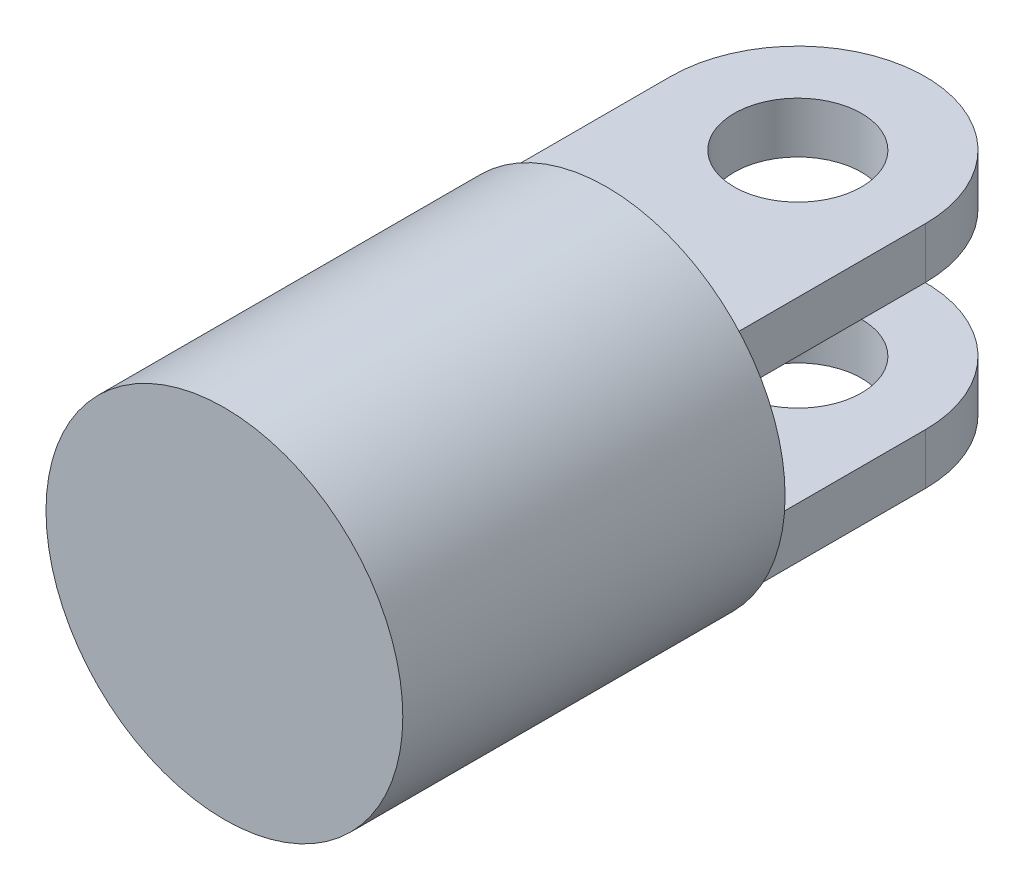
from build123d import *

# Parameters (mm, degrees)
SKETCH_1_R          = 14
EXTRUDE_1_DEPTH     = 30
SKETCH_2_R          = 5
EXTRUDE_2_DEPTH     = 9
SKETCH_2_3_R        = 5
CUT_EXTRUDE_1_DEPTH = 5


with BuildPart() as part:
    # 草图1 → 凸台-拉伸1 (new body)
    with BuildSketch(Plane.XY):
        Circle(SKETCH_1_R)
    extrude(amount=EXTRUDE_1_DEPTH)

    # 草图2 → 凸台-拉伸2 (add, symmetric)
    with BuildSketch(Plane(origin=(0, 0, 0), x_dir=(1, 0, 0), z_dir=(0, 1, 0))):
        with BuildLine():
            Line((10, 15), (10, 0))
            Line((10, 0), (-10, 0))
            Line((-10, 0), (-10, 15))
            ThreePointArc((-10, 15), (0, 25), (10, 15))
        make_face()
        with Locations((0, 15)):
            Circle(SKETCH_2_R, mode=Mode.SUBTRACT)
    extrude(amount=EXTRUDE_2_DEPTH, both=True)

    # 草图2<3> → 切除-拉伸1 (cut, symmetric)
    with BuildSketch(Plane(origin=(0, 0, 0), x_dir=(1, 0, 0), z_dir=(0, 1, 0))):
        with BuildLine():
            Line((10, 15), (10, 0))
            Line((10, 0), (-10, 0))
            Line((-10, 0), (-10, 15))
            ThreePointArc((-10, 15), (0, 25), (10, 15))
        make_face()
        with Locations((0, 15)):
            Circle(SKETCH_2_3_R, mode=Mode.SUBTRACT)
    extrude(amount=CUT_EXTRUDE_1_DEPTH, both=True, mode=Mode.SUBTRACT)


solid = part.part
